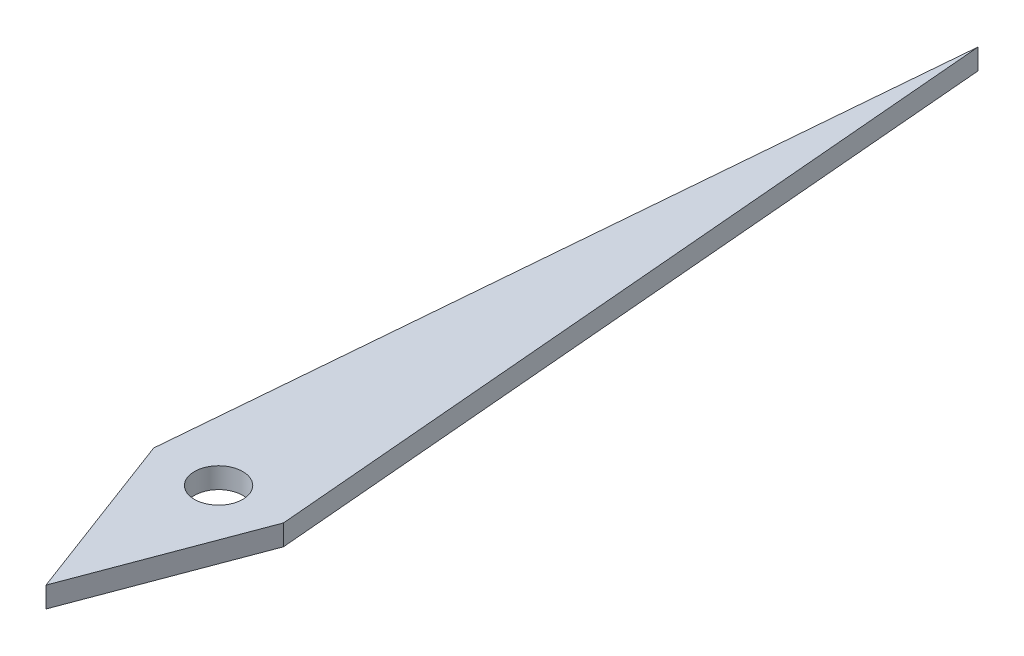
from build123d import *

# Parameters (mm, degrees)
BOSS_EXTRUDE1_DEPTH = 0.3
SKETCH2_R           = 0.35
CUT_EXTRUDE1_DEPTH  = 0.3


with BuildPart() as part:
    # Sketch1 → Boss-Extrude1 (new body)
    with BuildSketch(Plane(origin=(0, 0, 0), x_dir=(1, 0, 0), z_dir=(0, 1, 0))):
        Polygon((-0.94, 0), (0, 11), (0.94, 0), (0, -2.5), align=None)
    extrude(amount=BOSS_EXTRUDE1_DEPTH)

    # Sketch2 → Cut-Extrude1 (cut)
    with BuildSketch(Plane(origin=(0, 0.3, 0), x_dir=(1, 0, 0), z_dir=(0, 1, 0))):
        with Locations(Location((0, 0, 0), (0, 0, 270))):
            Circle(SKETCH2_R)
    extrude(amount=-CUT_EXTRUDE1_DEPTH, mode=Mode.SUBTRACT)


solid = part.part
